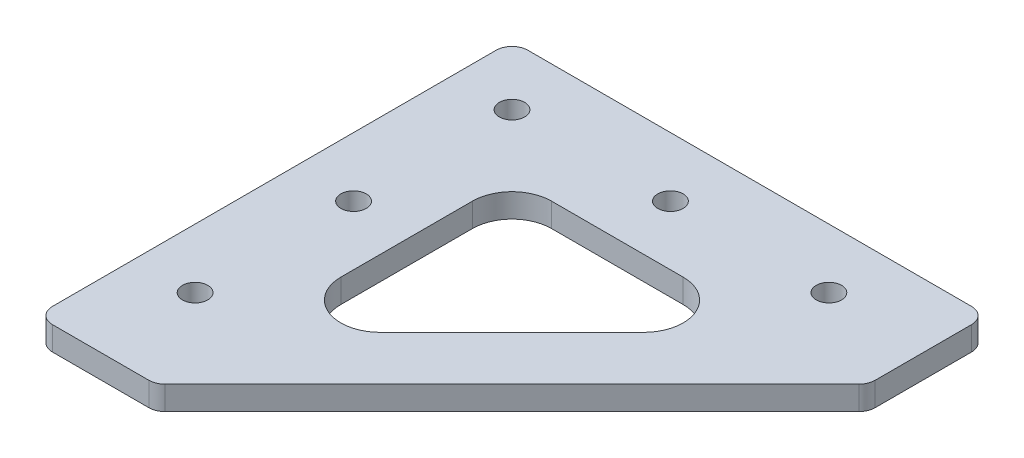
from build123d import *

# Parameters (mm, degrees)
SKETCH_1_R      = 1.6
EXTRUDE_1_DEPTH = 3
FILLET_1_R      = 2
FILLET_2_R      = 5


with BuildPart() as part:
    # 草图1 → 凸台-拉伸1 (new body)
    with BuildSketch(Plane(origin=(0, 0, 0), x_dir=(1, 0, 0), z_dir=(0, 1, 0))):
        Polygon((0, -45), (-15, -45), (-15, 15), (45, 15), (45, 0), align=None)
        with Locations(Location((-7.5, -12.5, 0), (0, 0, 270))):
            Circle(SKETCH_1_R, mode=Mode.SUBTRACT)
        with Locations(Location((-7.5, -32.5, 0), (0, 0, 270))):
            Circle(SKETCH_1_R, mode=Mode.SUBTRACT)
        with Locations(Location((-7.5, 7.5, 0), (0, 0, 270))):
            Circle(SKETCH_1_R, mode=Mode.SUBTRACT)
        with Locations(Location((12.5, 7.5, 0), (0, 0, 270))):
            Circle(SKETCH_1_R, mode=Mode.SUBTRACT)
        with Locations(Location((32.5, 7.5, 0), (0, 0, 270))):
            Circle(SKETCH_1_R, mode=Mode.SUBTRACT)
        Polygon((0, -33.686291501), (0, 0), (33.686291501, 0), align=None, mode=Mode.SUBTRACT)
    extrude(amount=EXTRUDE_1_DEPTH)

    # 圆角1
    fillet_1_edges = [part.edges().sort_by_distance(p)[0] for p in [
        (0, 1.5, 45),
        (-15, 1.5, 45),
        (-15, 1.5, -15),
        (45, 1.5, -15),
        (45, 1.5, 0),
    ]]
    fillet(fillet_1_edges, radius=FILLET_1_R)

    # 圆角2
    fillet_2_edges = [part.edges().sort_by_distance(p)[0] for p in [
        (33.686291501, 1.5, 0),
        (0, 1.5, 0),
        (0, 1.5, 33.686291501),
    ]]
    fillet(fillet_2_edges, radius=FILLET_2_R)


solid = part.part
